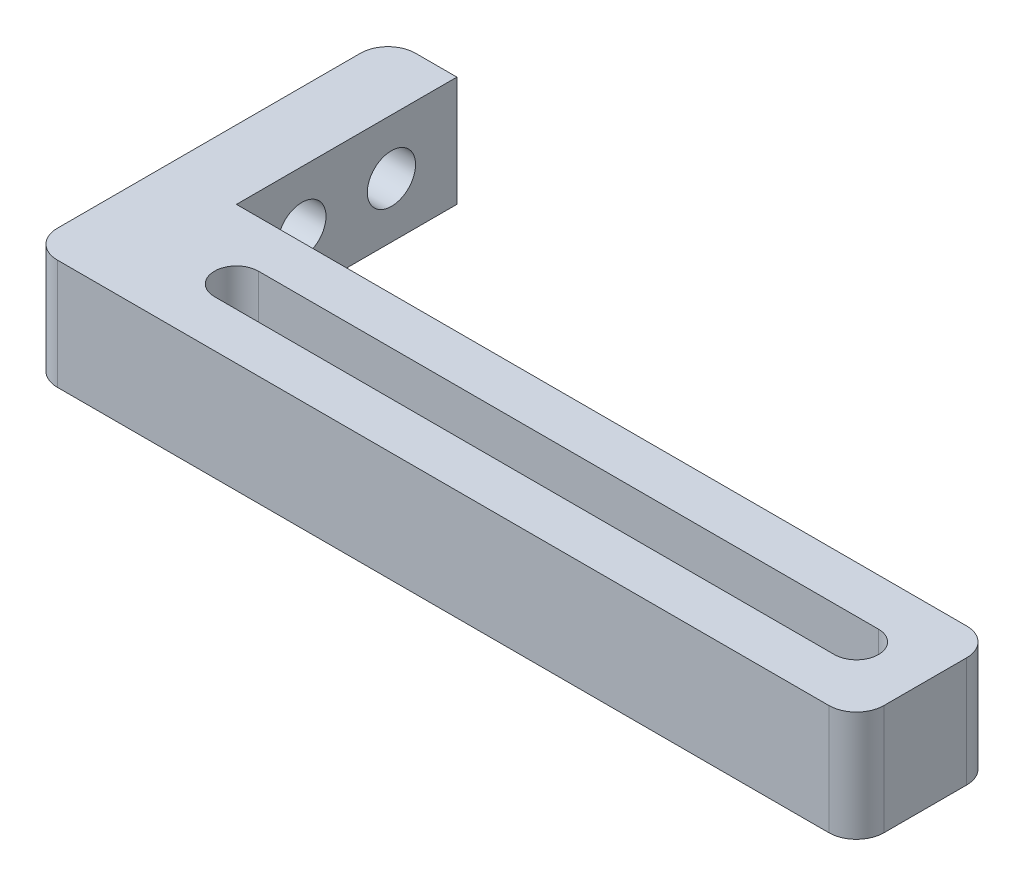
from build123d import *

# Parameters (mm, degrees)
BOSS_EXTRUDE1_DEPTH = 8
SKETCH2_R           = 1.75
CUT_EXTRUDE1_DEPTH  = 62.359595827
CUT_EXTRUDE2_DEPTH  = 66.878676368
CUT_EXTRUDE3_DEPTH  = 3
FILLET1_R           = 2


with BuildPart() as part:
    # Sketch1 → Boss-Extrude1 (new body)
    with BuildSketch(Plane(origin=(0, 0, 0), x_dir=(1, 0, 0), z_dir=(0, 1, 0))):
        Polygon((0, 26), (0, 0), (60, 0), (60, 10), (5, 10), (5, 26), align=None)
    extrude(amount=BOSS_EXTRUDE1_DEPTH)

    # Sketch2 → Cut-Extrude1 (cut, through all)
    with BuildSketch(Plane(origin=(5, 0, 0), x_dir=(0, 0, -1), z_dir=(1, 0, 0))):
        with Locations((21.25, 4)):
            Circle(SKETCH2_R)
        with Locations((14.75, 4)):
            Circle(SKETCH2_R)
    extrude(amount=-CUT_EXTRUDE1_DEPTH, mode=Mode.SUBTRACT)

    # Sketch3 → Cut-Extrude2 (cut, through all)
    with BuildSketch(Plane(origin=(0, 8, 0), x_dir=(1, 0, 0), z_dir=(0, 1, 0))):
        with BuildLine():
            Line((10, 6.6), (55, 6.6))
            ThreePointArc((55, 6.6), (56.6, 5), (55, 3.4))
            Line((55, 3.4), (10, 3.4))
            ThreePointArc((10, 3.4), (8.4, 5), (10, 6.6))
        make_face()
    extrude(amount=-CUT_EXTRUDE2_DEPTH, mode=Mode.SUBTRACT)

    # Sketch4 → Cut-Extrude3 (cut)
    with BuildSketch(Plane.XZ):
        with BuildLine():
            Line((55, -7.85), (10, -7.85))
            ThreePointArc((10, -7.85), (7.15, -5), (10, -2.15))
            Line((10, -2.15), (55, -2.15))
            ThreePointArc((55, -2.15), (57.85, -5), (55, -7.85))
        make_face()
    extrude(amount=-CUT_EXTRUDE3_DEPTH, mode=Mode.SUBTRACT)

    # Fillet1
    fillet1_edges = [part.edges().sort_by_distance(p)[0] for p in [
        (60, 4, -10),
        (60, 4, 0),
        (0, 4, 0),
        (0, 4, -26),
    ]]
    fillet(fillet1_edges, radius=FILLET1_R)


solid = part.part
